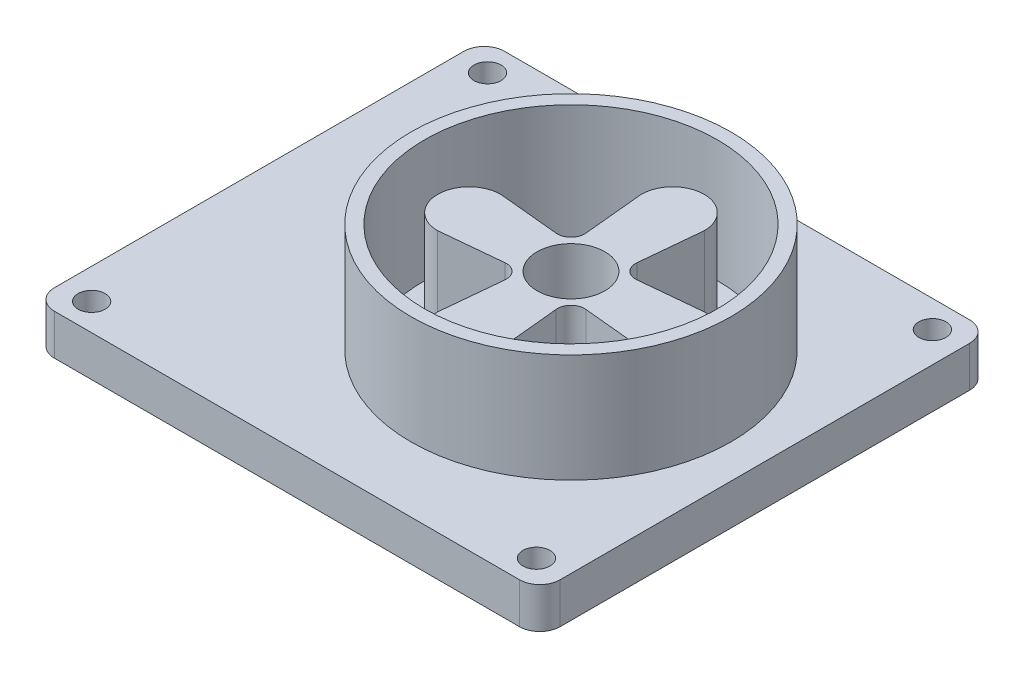
from build123d import *

# Parameters (mm, degrees)
SKETCH1_R           = 11.8
SKETCH1_R_2         = 1
BOSS_EXTRUDE1_DEPTH = 3
SKETCH3_R           = 11.8
BOSS_EXTRUDE2_DEPTH = 11
SHELL1_T            = -1
SKETCH4_R           = 2.5
CUT_EXTRUDE2_DEPTH  = 3
BOSS_EXTRUDE4_DEPTH = 7
SKETCH6_R           = 2.5
CUT_EXTRUDE3_DEPTH  = 27.895771043


with BuildPart() as part:
    # Sketch1 → Boss-Extrude1 (new body)
    with BuildSketch(Plane(origin=(0, 0, 0), x_dir=(1, 0, 0), z_dir=(0, 1, 0))):
        with BuildLine():
            Line((-17.15, 16.6), (17.15, 16.6))
            ThreePointArc((17.15, 16.6), (18.210660172, 16.160660172), (18.65, 15.1))
            Line((18.65, 15.1), (18.65, -15.1))
            ThreePointArc((18.65, -15.1), (18.210660172, -16.160660172), (17.15, -16.6))
            Line((17.15, -16.6), (-17.15, -16.6))
            ThreePointArc((-17.15, -16.6), (-18.210660172, -16.160660172), (-18.65, -15.1))
            Line((-18.65, -15.1), (-18.65, 15.1))
            ThreePointArc((-18.65, 15.1), (-18.210660172, 16.160660172), (-17.15, 16.6))
        make_face()
        with Locations(Location((4.35, 0, 0), (0, 0, 270))):
            Circle(SKETCH1_R, mode=Mode.SUBTRACT)
        with Locations(Location((-16.403012048, 14.6, 0), (0, 0, 270))):
            Circle(SKETCH1_R_2, mode=Mode.SUBTRACT)
        with Locations(Location((16.403012048, 14.6, 0), (0, 0, 90))):
            Circle(SKETCH1_R_2, mode=Mode.SUBTRACT)
        with Locations(Location((16.403012048, -14.6, 0), (0, 0, 270))):
            Circle(SKETCH1_R_2, mode=Mode.SUBTRACT)
        with Locations(Location((-16.403012048, -14.6, 0), (0, 0, 90))):
            Circle(SKETCH1_R_2, mode=Mode.SUBTRACT)
    extrude(amount=BOSS_EXTRUDE1_DEPTH)

    # Sketch3 → Boss-Extrude2 (add)
    with BuildSketch(Plane(origin=(0, 0, 0), x_dir=(1, 0, 0), z_dir=(0, 1, 0))):
        with Locations(Location((4.35, 0, 0), (0, 0, 270))):
            Circle(SKETCH3_R)
    extrude(amount=BOSS_EXTRUDE2_DEPTH)

    # Shell1
    shell1_openings = [part.faces().sort_by_distance(p)[0] for p in [
        (4.35, 11, 0),
    ]]
    offset(amount=SHELL1_T, openings=shell1_openings, kind=Kind.INTERSECTION)

    # Sketch4 → Cut-Extrude2 (cut)
    with BuildSketch(Plane.XZ):
        with Locations(Location((4.35, 0, 0), (0, 0, 270))):
            Circle(SKETCH4_R)
    extrude(amount=-CUT_EXTRUDE2_DEPTH, mode=Mode.SUBTRACT)

    # Sketch5 → Boss-Extrude4 (add)
    with BuildSketch(Plane(origin=(0, 1, 0), x_dir=(1, 0, 0), z_dir=(0, 1, 0))):
        with BuildLine():
            Line((2.02679539, 7.505692886), (2.465229351, 2.97646884))
            ThreePointArc((2.465229351, 2.97646884), (2.176988688, 2.173011312), (1.37353116, 1.884770649))
            Line((1.37353116, 1.884770649), (-3.155692886, 2.32320461))
            ThreePointArc((-3.155692886, 2.32320461), (-5.478897496, 0), (-3.155692886, -2.32320461))
            Line((-3.155692886, -2.32320461), (1.37353116, -1.884770649))
            ThreePointArc((1.37353116, -1.884770649), (2.176988688, -2.173011312), (2.465229351, -2.97646884))
            Line((2.465229351, -2.97646884), (2.02679539, -7.505692886))
            ThreePointArc((2.02679539, -7.505692886), (4.35, -9.828897496), (6.67320461, -7.505692886))
            Line((6.67320461, -7.505692886), (6.234770649, -2.97646884))
            ThreePointArc((6.234770649, -2.97646884), (6.523011312, -2.173011312), (7.32646884, -1.884770649))
            Line((7.32646884, -1.884770649), (11.855692886, -2.32320461))
            ThreePointArc((11.855692886, -2.32320461), (14.178897496, 0), (11.855692886, 2.32320461))
            Line((11.855692886, 2.32320461), (7.32646884, 1.884770649))
            ThreePointArc((7.32646884, 1.884770649), (6.523011312, 2.173011312), (6.234770649, 2.97646884))
            Line((6.234770649, 2.97646884), (6.67320461, 7.505692886))
            ThreePointArc((6.67320461, 7.505692886), (4.35, 9.828897496), (2.02679539, 7.505692886))
        make_face()
    extrude(amount=BOSS_EXTRUDE4_DEPTH)

    # Sketch6 → Cut-Extrude3 (cut, through all)
    with BuildSketch(Plane.XZ.offset(-1)):
        with Locations(Location((4.35, 0, 0), (0, 0, 270))):
            Circle(SKETCH6_R)
    extrude(amount=-CUT_EXTRUDE3_DEPTH, mode=Mode.SUBTRACT)


solid = part.part
